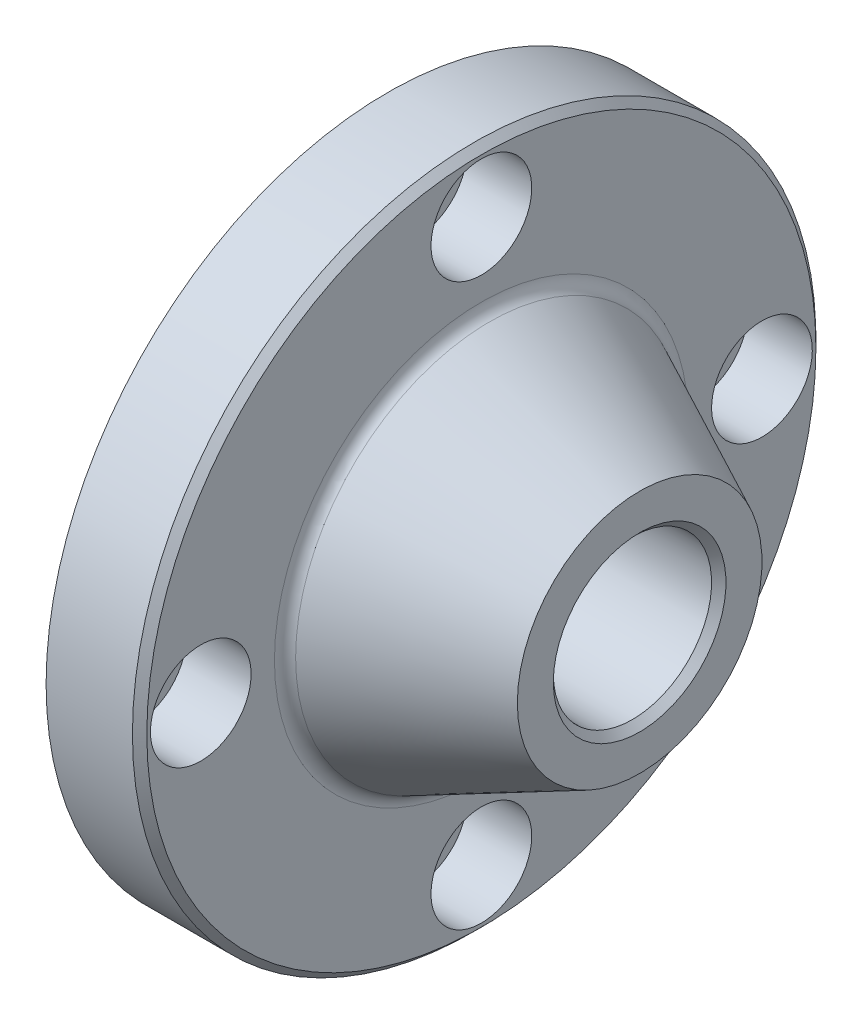
from build123d import *

# Parameters (mm, degrees)
CHAMFER_1_SIZE           = 1
CHAMFER_2_SIZE           = 1
CHAMFER_3_SIZE           = 1
FILLET_1_R               = 2
SKETCH_2_R               = 4.5
CUT_EXTRUDE_1_DEPTH      = 72.003521039
CUT_EXTRUDE_START        = -13
SKETCH_3_R               = 7
CUT_EXTRUDE_2_DEPTH      = 9
PATTERN_CIRCULAR_2_COUNT = 4


with BuildPart() as part:
    # 草图1 → 旋转1 (revolve)
    with BuildSketch(Plane.XY, mode=Mode.PRIVATE) as revolve_1_sk:
        Polygon((45, 11), (45, 17), (23, 27.5), (23, 47.5), (10, 47.5), (10, 31), (0, 31), (0, 22.5), (15, 22.5), (15, 11), align=None)
    revolve(revolve_1_sk.sketch.rotate(Axis((0, 0, 0), (1, 0, 0)), 90), axis=Axis((0, 0, 0), (1, 0, 0)))

    # 倒角1
    chamfer_1_edges = [part.edges().sort_by_distance(p)[0] for p in [
        (45, 0, -11),
    ]]
    chamfer(chamfer_1_edges, length=CHAMFER_1_SIZE)

    # 倒角2
    chamfer_2_edges = [part.edges().sort_by_distance(p)[0] for p in [
        (0, 0, -31),
    ]]
    chamfer(chamfer_2_edges, length=CHAMFER_2_SIZE)

    # 倒角3
    chamfer_3_edges = [part.edges().sort_by_distance(p)[0] for p in [
        (23, 0, -47.5),
    ]]
    chamfer(chamfer_3_edges, length=CHAMFER_3_SIZE)

    # 圆角1
    fillet_1_edges = [part.edges().sort_by_distance(p)[0] for p in [
        (23, 0, -27.5),
    ]]
    fillet(fillet_1_edges, radius=FILLET_1_R)

    # 草图2 → 切除-拉伸1 (cut, through all)
    with BuildSketch(Plane(origin=(23, 0, 0), x_dir=(0, 0, -1), z_dir=(1, 0, 0))):
        with Locations((0, 39)):
            Circle(SKETCH_2_R)
    cut_extrude_1 = extrude(amount=-CUT_EXTRUDE_1_DEPTH, mode=Mode.SUBTRACT)

    # 草图3 → 切除-拉伸2 (cut)
    with BuildSketch(Plane.ZY.offset(-10).offset(CUT_EXTRUDE_START)):
        with Locations((0, 39)):
            Circle(SKETCH_3_R)
    cut_extrude_2 = extrude(amount=CUT_EXTRUDE_2_DEPTH, mode=Mode.SUBTRACT)

    # 阵列(圆周)2: 切除-拉伸1, 切除-拉伸2 ×4 about axis
    pattern_circular_2_axis = Axis((0, 0, 0), (1, 0, 0))
    add([cut_extrude_1.rotate(pattern_circular_2_axis, i * 360 / PATTERN_CIRCULAR_2_COUNT) for i in range(1, PATTERN_CIRCULAR_2_COUNT)], mode=Mode.SUBTRACT)
    add([cut_extrude_2.rotate(pattern_circular_2_axis, i * 360 / PATTERN_CIRCULAR_2_COUNT) for i in range(1, PATTERN_CIRCULAR_2_COUNT)], mode=Mode.SUBTRACT)


solid = part.part
